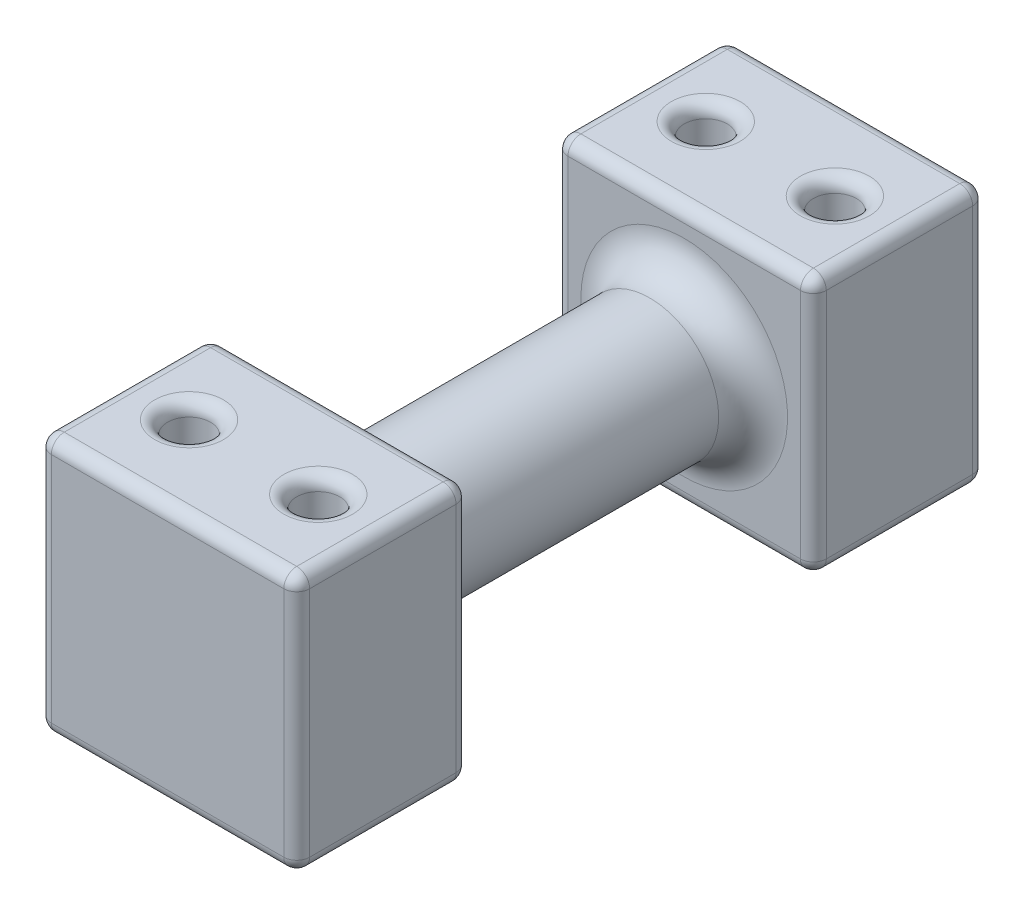
from build123d import *

# Parameters (mm, degrees)
CROQUIS1_W              = 15
CROQUIS1_H              = 15
SALIENTE_EXTRUIR1_DEPTH = 10
CROQUIS2_R              = 4
SALIENTE_EXTRUIR2_DEPTH = 10
CROQUIS3_R              = 1.25
CORTAR_EXTRUIR1_DEPTH   = 30.154759474
REDONDEO1_R             = 0.75
REDONDEO2_R             = 2


with BuildPart() as part:
    # Croquis1 → Saliente-Extruir1 (new body)
    with BuildSketch(Plane.XY):
        with Locations((7.5, 7.5)):
            Rectangle(CROQUIS1_W, CROQUIS1_H)
    extrude(amount=SALIENTE_EXTRUIR1_DEPTH)

    # Croquis2 → Saliente-Extruir2 (add)
    with BuildSketch(Plane.XY.offset(10)):
        with Locations((7.5, 7.5)):
            Circle(CROQUIS2_R)
    extrude(amount=SALIENTE_EXTRUIR2_DEPTH)

    # Croquis3 → Cortar-Extruir1 (cut, through all)
    with BuildSketch(Plane(origin=(0, 15, 0), x_dir=(1, 0, 0), z_dir=(0, 1, 0))):
        with Locations(Location((3.75, -5, 0), (0, 0, 270))):
            Circle(CROQUIS3_R)
        with Locations(Location((11.25, -5, 0), (0, 0, 270))):
            Circle(CROQUIS3_R)
    extrude(amount=-CORTAR_EXTRUIR1_DEPTH, mode=Mode.SUBTRACT)

    # Simetría1: part across plane


with BuildPart() as part_1:
    add(part.part)
    add(part.part.mirror(Plane(origin=(7.5, 7.5, 20), x_dir=(1, 0, 0), z_dir=(0, 0, 1))))

    # Redondeo1
    redondeo1_edges = [part_1.edges().sort_by_distance(p)[0] for p in [
        (15, 7.5, 10),
        (7.5, 15, 10),
        (3.75, 0, 3.75),
        (3.75, 15, 3.75),
        (11.25, 0, 3.75),
        (11.25, 15, 3.75),
        (0, 7.5, 30),
        (0, 0, 35),
        (7.5, 0, 30),
        (15, 0, 35),
        (15, 7.5, 30),
        (15, 15, 35),
        (3.75, 15, 36.25),
        (11.25, 15, 36.25),
        (7.5, 15, 30),
        (0, 15, 35),
        (0, 7.5, 40),
        (7.5, 0, 40),
        (15, 7.5, 40),
        (7.5, 15, 40),
        (11.25, 0, 36.25),
        (3.75, 0, 36.25),
        (0, 7.5, 10),
        (7.5, 15, 0),
        (15, 7.5, 0),
        (7.5, 0, 0),
        (0, 7.5, 0),
        (0, 15, 5),
        (15, 15, 5),
        (15, 0, 5),
        (0, 0, 5),
        (7.5, 0, 10),
    ]]
    fillet(redondeo1_edges, radius=REDONDEO1_R)

    # Redondeo2
    redondeo2_edges = [part_1.edges().sort_by_distance(p)[0] for p in [
        (3.5, 7.5, 10),
        (3.5, 7.5, 30),
    ]]
    fillet(redondeo2_edges, radius=REDONDEO2_R)


solid = part_1.part
